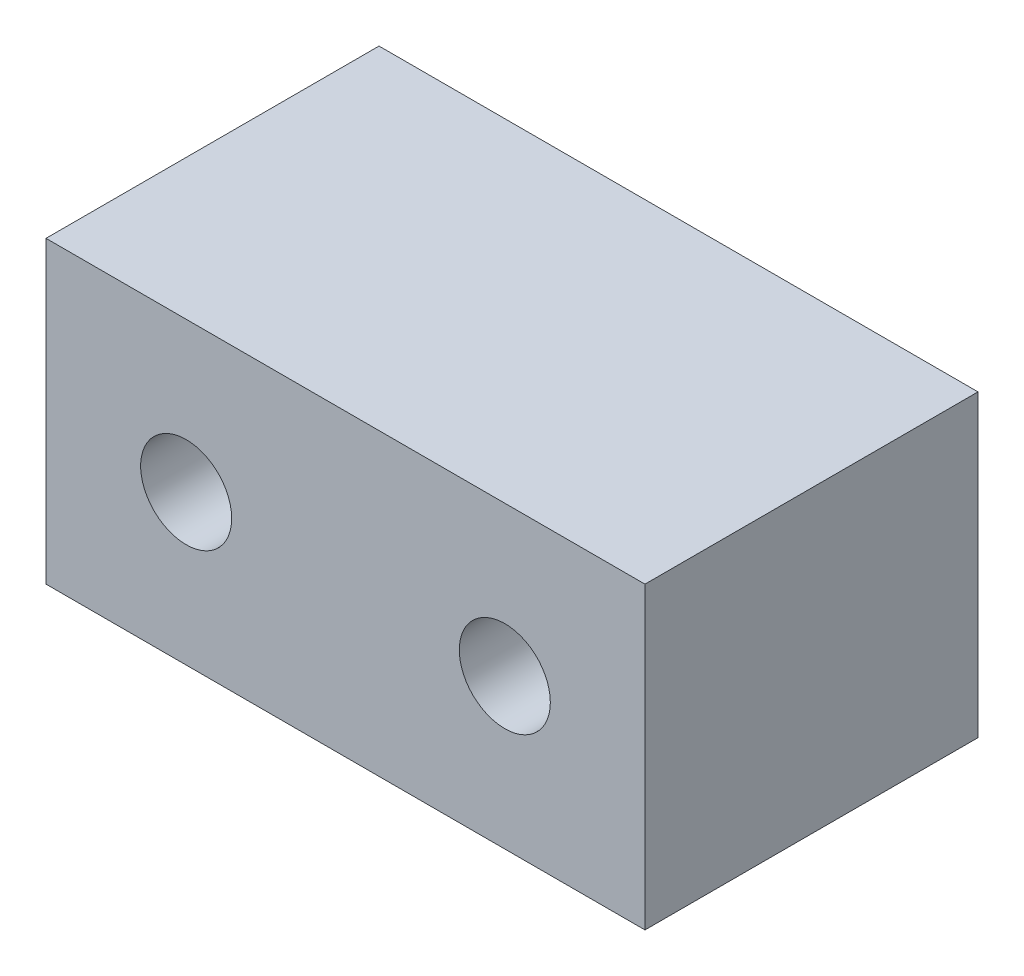
from build123d import *

# Parameters (mm, degrees)
SKETCH1_W           = 12.7
SKETCH1_H           = 6.35
SKETCH1_R           = 0.9652
BOSS_EXTRUDE1_DEPTH = 7.0612
SKETCH1_3_R         = 1.9939
SKETCH1_3_R_2       = 0.9652
CUT_EXTRUDE1_DEPTH  = 3.556


with BuildPart() as part:
    # Sketch1 → Boss-Extrude1 (new body)
    with BuildSketch(Plane.XY):
        Rectangle(SKETCH1_W, SKETCH1_H)
        with Locations((-3.3782, 0)):
            Circle(SKETCH1_R, mode=Mode.SUBTRACT)
        with Locations((3.3782, 0)):
            Circle(SKETCH1_R, mode=Mode.SUBTRACT)
    extrude(amount=BOSS_EXTRUDE1_DEPTH)

    # Sketch1<3> → Cut-Extrude1 (cut)
    # profile 1 of 2: a face of its own
    with BuildSketch(Plane.XY):
        with Locations((-3.3782, 0)):
            Circle(SKETCH1_3_R)
        with Locations((-3.3782, 0)):
            Circle(SKETCH1_3_R_2, mode=Mode.SUBTRACT)
    # profile 2 of 2: a face of its own
    with BuildSketch(Plane.XY):
        with Locations((3.3782, 0)):
            Circle(SKETCH1_3_R)
        with Locations((3.3782, 0)):
            Circle(SKETCH1_3_R_2, mode=Mode.SUBTRACT)
    extrude(amount=CUT_EXTRUDE1_DEPTH, mode=Mode.SUBTRACT)


solid = part.part
